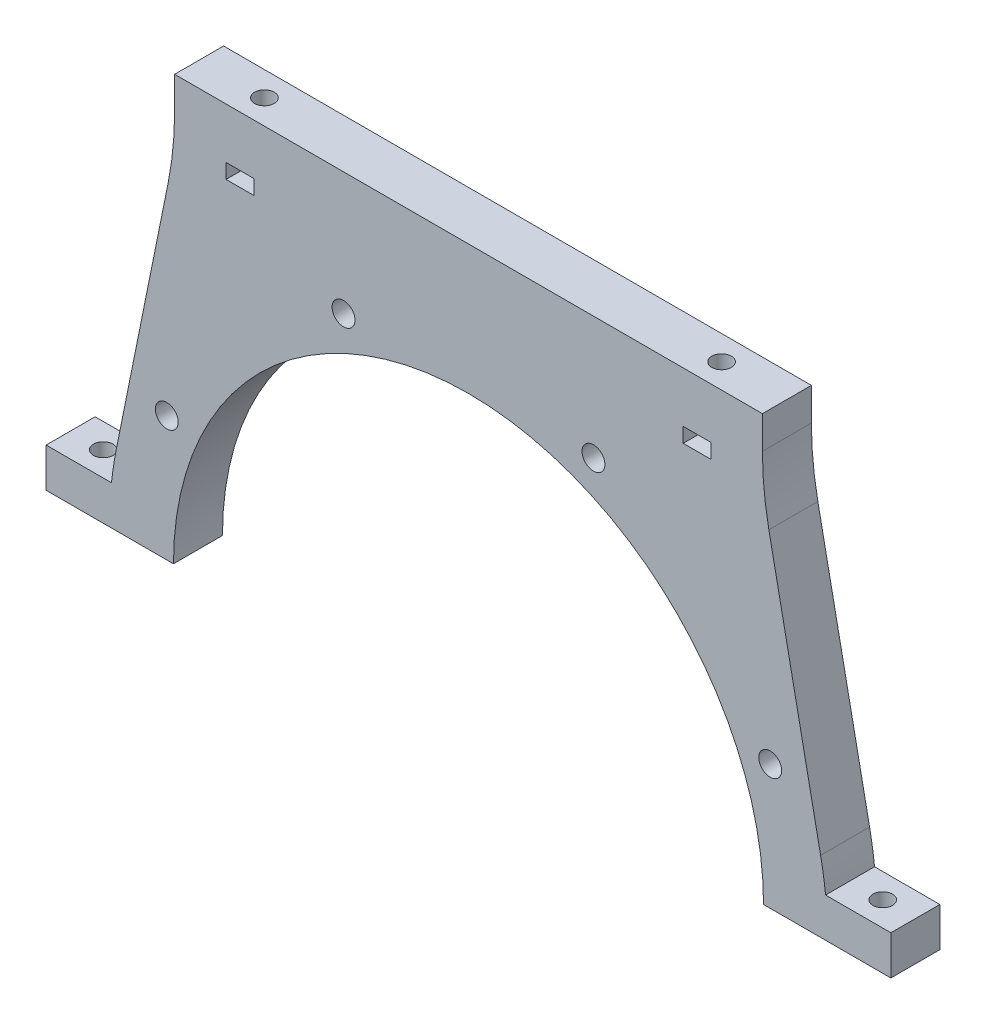
from build123d import *

# Parameters (mm, degrees)
EXTRUDE_1_DEPTH     = 15
SKETCH_2_R          = 3.5
CUT_EXTRUDE_2_DEPTH = 15
EXTRUDE_START       = -15
EXTRUDE_2_DEPTH     = 15
CUT_EXTRUDE_3_REACH = 164.969
SKETCH_4_R          = 3
EXTRUDE_3_DEPTH     = 15
FILLET_2_R          = 100
FILLET_3_R          = 100
SKETCH_6_R          = 3
CUT_EXTRUDE_4_DEPTH = 30
CUT_EXTRUDE_5_DEPTH = 4.5


with BuildPart() as part:
    # 草图1 → 凸台-拉伸1 (new body)
    with BuildSketch(Plane.XY):
        with BuildLine():
            Line((-90.35, 0), (-110, 0))
            ThreePointArc((-110, 0), (0, 110), (110, 0))
            Line((110, 0), (90.35, 0))
            ThreePointArc((90.35, 0), (0, 90.35), (-90.35, 0))
        make_face()
    extrude(amount=EXTRUDE_1_DEPTH)

    # 草图2 → 切除-拉伸2 (cut)
    with BuildSketch(Plane.XY.offset(15)):
        with Locations((38.268343237, 92.387953251)):
            Circle(SKETCH_2_R)
        with Locations((92.387953251, 38.268343237)):
            Circle(SKETCH_2_R)
        with Locations((92.387953251, -38.268343237)):
            Circle(SKETCH_2_R)
        with Locations((38.268343237, -92.387953251)):
            Circle(SKETCH_2_R)
        with Locations((-38.268343237, -92.387953251)):
            Circle(SKETCH_2_R)
        with Locations((-92.387953251, -38.268343237)):
            Circle(SKETCH_2_R)
        with Locations((-92.387953251, 38.268343237)):
            Circle(SKETCH_2_R)
        with Locations((-38.268343237, 92.387953251)):
            Circle(SKETCH_2_R)
    extrude(amount=-CUT_EXTRUDE_2_DEPTH, mode=Mode.SUBTRACT)

    # 草图3 → 凸台-拉伸2 (add)
    with BuildSketch(Plane.XY.offset(15).offset(EXTRUDE_START)):
        with BuildLine():
            Line((-110, 0), (-129.343495463, 0))
            Line((-129.343495463, 0), (-129.343495463, 12))
            Line((-129.343495463, 12), (-109.343495463, 12))
            ThreePointArc((-109.343495463, 12), (-109.83575124, 6.008972421), (-110, 0))
        make_face()
        with BuildLine():
            Line((129.343495463, 12), (109.343495463, 12))
            ThreePointArc((109.343495463, 12), (109.83575124, 6.008972421), (110, 0))
            Line((110, 0), (129.343495463, 0))
            Line((129.343495463, 0), (129.343495463, 12))
        make_face()
    extrude(amount=EXTRUDE_2_DEPTH)

    # 草图4 → 切除-拉伸3 (cut, up to next)
    with BuildSketch(Plane(origin=(0, 12, 0), x_dir=(1, 0, 0), z_dir=(0, 1, 0)), mode=Mode.PRIVATE) as cut_extrude_3_sk1:
        with Locations(Location((-119.343495463, -7.5, 0), (0, 0, 270))):
            Circle(SKETCH_4_R)
    cut_extrude_3_tool1 = extrude(cut_extrude_3_sk1.sketch, amount=-CUT_EXTRUDE_3_REACH, mode=Mode.PRIVATE) & part.part
    cut_extrude_3 = cut_extrude_3_tool1.solids().sort_by_distance((-119.343495, 12, 7.5))[0]
    add(cut_extrude_3, mode=Mode.SUBTRACT)

    # 镜向1: 切除-拉伸3 across plane
    add(cut_extrude_3.mirror(Plane.ZY), mode=Mode.SUBTRACT)

    # 草图5 → 凸台-拉伸3 (add)
    with BuildSketch(Plane.XY.offset(15).offset(EXTRUDE_START)):
        with BuildLine():
            Line((-90, 130), (90, 130))
            Line((90, 130), (90, 110))
            Line((90, 110), (107.821782178, 21.782178218))
            ThreePointArc((107.821782178, 21.782178218), (0, 110), (-107.821782178, 21.782178218))
            Line((-107.821782178, 21.782178218), (-90, 110))
            Line((-90, 110), (-90, 130))
        make_face()
    extrude(amount=EXTRUDE_3_DEPTH)

    # 圆角2
    fillet_2_edges = [part.edges().sort_by_distance(p)[0] for p in [
        (90, 110, 7.5),
    ]]
    fillet(fillet_2_edges, radius=FILLET_2_R)

    # 圆角3
    fillet_3_edges = [part.edges().sort_by_distance(p)[0] for p in [
        (-90, 110, 7.5),
    ]]
    fillet(fillet_3_edges, radius=FILLET_3_R)

    # 草图6 → 切除-拉伸4 (cut)
    with BuildSketch(Plane(origin=(0, 130, 0), x_dir=(1, 0, 0), z_dir=(0, 1, 0))):
        with Locations(Location((-70, -7.5, 0), (0, 0, 270))):
            Circle(SKETCH_6_R)
    cut_extrude_4 = extrude(amount=-CUT_EXTRUDE_4_DEPTH, mode=Mode.SUBTRACT)

    # 草图7 → 切除-拉伸5 (cut)
    with BuildSketch(Plane(origin=(0, 110, 0), x_dir=(1, 0, 0), z_dir=(0, 1, 0))):
        Polygon((-74.25, -9.953738644), (-74.25, -15), (-65.75, -15), (-65.75, -9.953738644), (-65.75, -5.046261356), (-70, -2.592522712), (-74.25, -5.046261356), align=None)
    cut_extrude_5 = extrude(amount=CUT_EXTRUDE_5_DEPTH, mode=Mode.SUBTRACT)

    # 镜向2: 切除-拉伸4, 切除-拉伸5 across plane
    add(cut_extrude_4.mirror(Plane.ZY), mode=Mode.SUBTRACT)
    add(cut_extrude_5.mirror(Plane.ZY), mode=Mode.SUBTRACT)


solid = part.part
